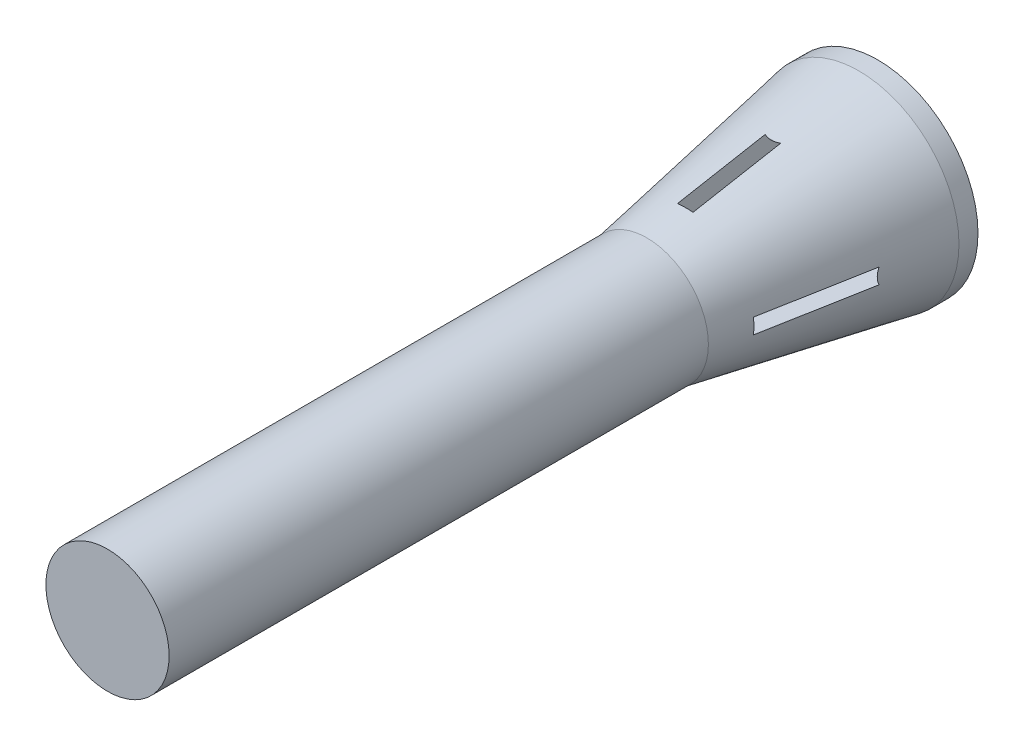
from build123d import *

# Parameters (mm, degrees)
ENL_V_MAT_EXTRU_1_DEPTH = 12.5


with BuildPart() as part:
    # Esquisse1 → Révolution1 (revolve)
    with BuildSketch(Plane(origin=(0, 0, 0), x_dir=(0, 0, -1), z_dir=(1, 0, 0)), mode=Mode.PRIVATE) as r_volution1_sk:
        Polygon((73.269946074, 13.728692904), (72.036236822, 13.728692904), (58.269946074, 11.228692904), (23.269946074, 11.228692904), (23.269946074, 7.228692904), (63.269946074, 7.228692904), (63.269946074, 10.228692904), (73.269946074, 10.228692904), align=None)
    revolve(r_volution1_sk.sketch.rotate(Axis((0, 7.228692904, -23.269946074), (0, 0, -1)), 90), axis=Axis((0, 7.228692904, -23.269946074), (0, 0, -1)))

    # Esquisse12 → Enlèv. mat.-Extru.1 (cut)
    with BuildSketch(Plane(origin=(0, 0, -73.269946074), x_dir=(-1, 0, 0), z_dir=(0, 0, -1))):
        Polygon((0.5, 7.728692904), (6.052650367, 7.728692904), (6.052650367, 6.728692904), (0.5, 6.728692904), (0.5, 2.030323732), (-0.5, 2.030323732), (-0.5, 6.728692904), (-5.684461256, 6.728692904), (-5.684461256, 7.728692904), (-0.5, 7.728692904), (-0.5, 12.693209271), (0.5, 12.693209271), align=None)
    extrude(amount=-ENL_V_MAT_EXTRU_1_DEPTH, mode=Mode.SUBTRACT)


solid = part.part
